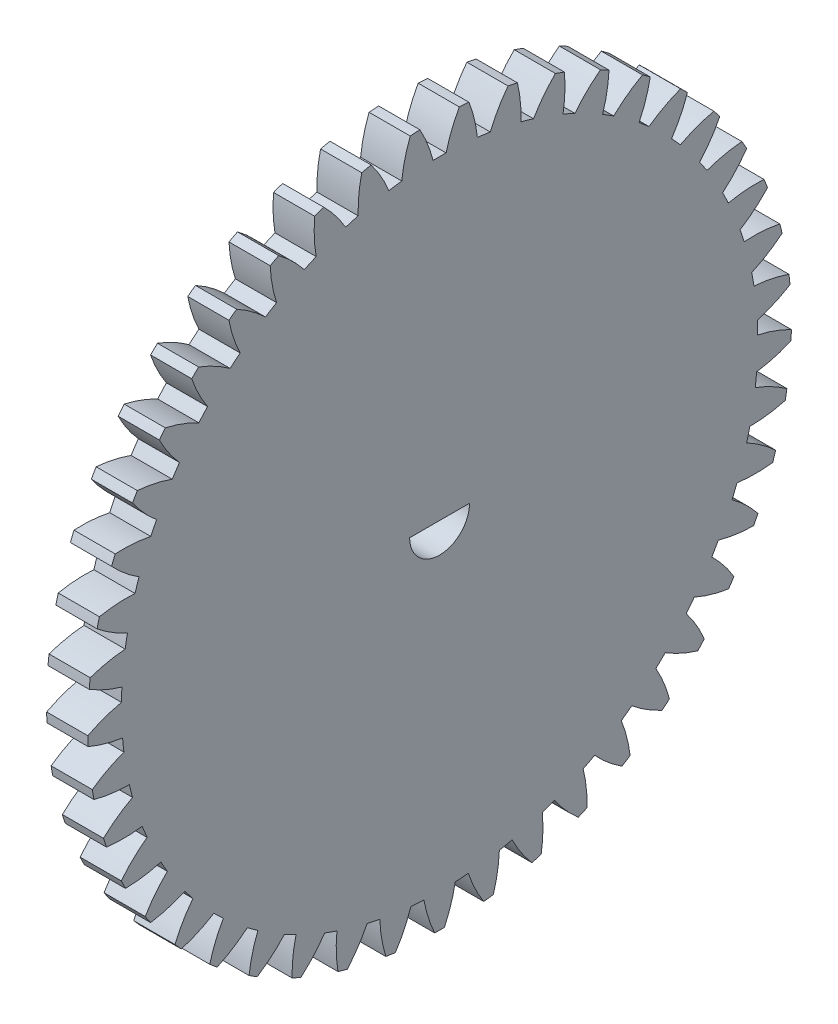
from build123d import *

# Parameters (mm, degrees)
BASPROSKE_W           = 5.5
BASPROSKE_H           = 47
TOOTHCUT_DEPTH        = 67.695202226
TEETHCUTS_COUNT       = 45
TEETHCUTS_ANGLE       = 352
BORSKE_R              = 0.4
BORE_DEPTH            = 50.0000508
CORTAR_EXTRUIR1_DEPTH = 6


with BuildPart() as part:
    # BasProSke → Base-Revolve (revolve)
    with BuildSketch(Plane(origin=(0, 0, 0), x_dir=(1, 0, 0), z_dir=(0, 1, 0)), mode=Mode.PRIVATE) as base_revolve_sk:
        with Locations((2.75, 23.5)):
            Rectangle(BASPROSKE_W, BASPROSKE_H)
    revolve(base_revolve_sk.sketch.rotate(Axis((-10, 0, 0), (1, 0, 0)), 180), axis=Axis((-10, 0, 0), (1, 0, 0)))

    # TooCutSke → ToothCut (cut, through all)
    with BuildSketch(Plane(origin=(0, 0, 0), x_dir=(0, 0, -1), z_dir=(1, 0, 0))):
        with BuildLine():
            ThreePointArc((0.870558136, 42.49008272), (0, 42.499), (-0.870558136, 42.49008272))
            ThreePointArc((-0.870558136, 42.49008272), (-1.611306544, 44.779997814), (-2.650928503, 46.950621117))
            ThreePointArc((-2.650928503, 46.950621117), (0, 47.0254), (2.650928503, 46.950621117))
            ThreePointArc((2.650928503, 46.950621117), (1.611306544, 44.779997814), (0.870558136, 42.49008272))
        make_face()
    toothcut = extrude(amount=TOOTHCUT_DEPTH, mode=Mode.SUBTRACT)

    # TeethCuts: ToothCut ×45 about axis
    teethcuts_axis = Axis((-10, 0, 0), (1, 0, 0))
    for i in range(1, TEETHCUTS_COUNT):
        add(toothcut.rotate(teethcuts_axis, i * TEETHCUTS_ANGLE / (TEETHCUTS_COUNT - 1)), mode=Mode.SUBTRACT)

    # BorSke → Bore (cut, symmetric)
    with BuildSketch(Plane(origin=(0, 0, 0), x_dir=(0, 0, -1), z_dir=(1, 0, 0))):
        with Locations(Location((0, 0, 0), (0, 0, 180))):
            Circle(BORSKE_R)
    extrude(amount=BORE_DEPTH, both=True, mode=Mode.SUBTRACT)

    # Croquis1 → Cortar-Extruir1 (cut)
    with BuildSketch(Plane(origin=(5.5, 0, 0), x_dir=(0, 0, -1), z_dir=(1, 0, 0))):
        with BuildLine():
            Line((-4, 0.4), (4, 0.4))
            ThreePointArc((4, 0.4), (0, -3.6), (-4, 0.4))
        make_face()
    extrude(amount=-CORTAR_EXTRUIR1_DEPTH, mode=Mode.SUBTRACT)


solid = part.part
